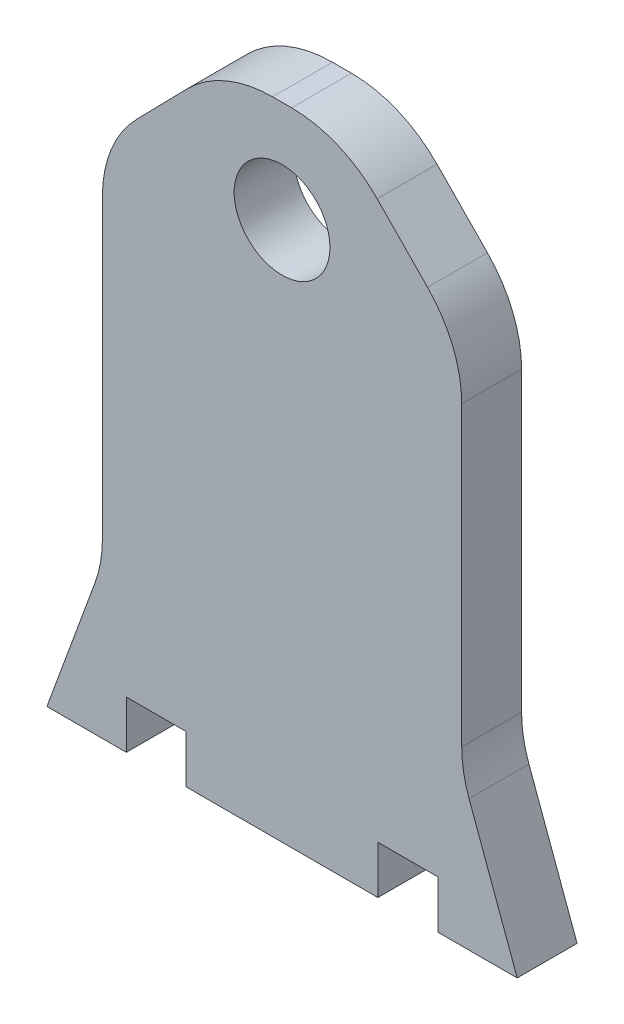
from build123d import *

# Parameters (mm, degrees)
ESQUISSE1_W             = 30
ESQUISSE1_H             = 67
ESQUISSE1_R             = 4
BOSS_EXTRU_1_DEPTH      = 5
ESQUISSE2_W             = 30
ESQUISSE2_H             = 12.5
ENL_V_MAT_EXTRU_1_DEPTH = 5
ESQUISSE3_W             = 5
ESQUISSE3_H             = 5
ENL_V_MAT_EXTRU_2_DEPTH = 38.043892884
BOSS_EXTRU_2_DEPTH      = 5
ENL_V_MAT_EXTRU_3_DEPTH = 40.33509883
ESQUISSE8_W             = 41.113396405
ESQUISSE8_H             = 1
ENL_V_MAT_EXTRU_4_DEPTH = 40.33509883
CONG_1_R                = 10
CONG_2_R                = 10


with BuildPart() as part:
    # Esquisse1 → Boss.-Extru.1 (new body)
    with BuildSketch(Plane.XY):
        Rectangle(ESQUISSE1_W, ESQUISSE1_H)
        with Locations((0, 12.5)):
            Circle(ESQUISSE1_R, mode=Mode.SUBTRACT)
    extrude(amount=BOSS_EXTRU_1_DEPTH)

    # Esquisse2 → Enlèv. mat.-Extru.1 (cut)
    with BuildSketch(Plane.XY.offset(5)):
        with Locations((0, 27.25)):
            Rectangle(ESQUISSE2_W, ESQUISSE2_H)
    extrude(amount=-ENL_V_MAT_EXTRU_1_DEPTH, mode=Mode.SUBTRACT)

    # Esquisse3 → Enlèv. mat.-Extru.2 (cut, through all)
    with BuildSketch(Plane.XY.offset(5)):
        with Locations((-10.5, -31)):
            Rectangle(ESQUISSE3_W, ESQUISSE3_H)
        with Locations((10.5, -31)):
            Rectangle(ESQUISSE3_W, ESQUISSE3_H)
    extrude(amount=-ENL_V_MAT_EXTRU_2_DEPTH, mode=Mode.SUBTRACT)

    # Esquisse5 → Boss.-Extru.2 (add)
    with BuildSketch(Plane.XY.offset(5)):
        Polygon((-15, -19.875), (-20, -33.5), (-15, -33.5), align=None)
        Polygon((15, -19.875), (20, -33.5), (15, -33.5), align=None)
    extrude(amount=-BOSS_EXTRU_2_DEPTH)

    # Esquisse6 → Enlèv. mat.-Extru.3 (cut, through all)
    with BuildSketch(Plane.XY.offset(5)):
        Polygon((-15, 10.78125), (-5, 21), (-15, 21), align=None)
        Polygon((15, 10.78125), (5, 21), (15, 21), align=None)
    extrude(amount=-ENL_V_MAT_EXTRU_3_DEPTH, mode=Mode.SUBTRACT)

    # Esquisse8 → Enlèv. mat.-Extru.4 (cut, through all)
    with BuildSketch(Plane.XY.offset(5)):
        with Locations((0.556698202, -33)):
            Rectangle(ESQUISSE8_W, ESQUISSE8_H)
    extrude(amount=-ENL_V_MAT_EXTRU_4_DEPTH, mode=Mode.SUBTRACT)

    # Congé1
    cong_1_edges = [part.edges().sort_by_distance(p)[0] for p in [
        (-15, 10.78125, 2.5),
        (-5, 21, 2.5),
        (15, 10.78125, 2.5),
        (5, 21, 2.5),
    ]]
    fillet(cong_1_edges, radius=CONG_1_R)

    # Congé2
    cong_2_edges = [part.edges().sort_by_distance(p)[0] for p in [
        (-15, -19.875, 2.5),
        (15, -19.875, 2.5),
    ]]
    fillet(cong_2_edges, radius=CONG_2_R)


solid = part.part
